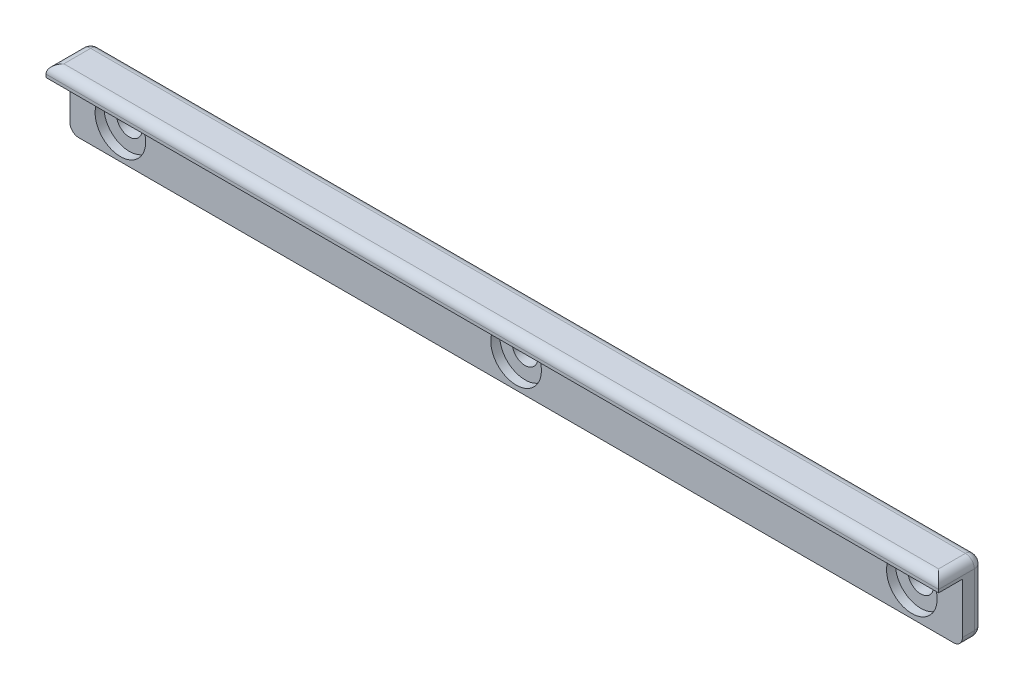
from build123d import *

# Parameters (mm, degrees)
SKETCH1_W                = 150
SKETCH1_H                = 10
SKETCH1_R                = 4.25
BOSS_EXTRUDE1_DEPTH      = 1.5
SKETCH2_W                = 150
SKETCH2_H                = 10
SKETCH2_R                = 2.15
BOSS_EXTRUDE2_DEPTH      = 2
BOSS_EXTRUDE3_DEPTH      = 4
BOSS_EXTRUDE3_DEPTH_BACK = 3.5
SKETCH3_W                = 150
SKETCH3_H                = 2
FILLET1_R                = 1.5


with BuildPart() as part:
    # Sketch1 → Boss-Extrude1 (new body)
    with BuildSketch(Plane.XY):
        with Locations((75, -5)):
            Rectangle(SKETCH1_W, SKETCH1_H)
        with Locations((75, -5)):
            Circle(SKETCH1_R, mode=Mode.SUBTRACT)
        with Locations((141.5, -5)):
            Circle(SKETCH1_R, mode=Mode.SUBTRACT)
        with Locations((8.5, -5)):
            Circle(SKETCH1_R, mode=Mode.SUBTRACT)
    extrude(amount=BOSS_EXTRUDE1_DEPTH)

    # Sketch2 → Boss-Extrude2 (add)
    with BuildSketch(Plane(origin=(0, 0, 0), x_dir=(-1, 0, 0), z_dir=(0, 0, -1))):
        with Locations((-75, -5)):
            Rectangle(SKETCH2_W, SKETCH2_H)
        with Locations((-8.5, -5)):
            Circle(SKETCH2_R, mode=Mode.SUBTRACT)
        with Locations((-75, -5)):
            Circle(SKETCH2_R, mode=Mode.SUBTRACT)
        with Locations((-141.5, -5)):
            Circle(SKETCH2_R, mode=Mode.SUBTRACT)
    extrude(amount=BOSS_EXTRUDE2_DEPTH)

    # Sketch3 → Boss-Extrude3 (add, two sides: drawn at the far end of the back side and taken through both)
    with BuildSketch(Plane.XY.offset(1.5).offset(-BOSS_EXTRUDE3_DEPTH_BACK)):
        with Locations((75, 1)):
            Rectangle(SKETCH3_W, SKETCH3_H)
    extrude(amount=BOSS_EXTRUDE3_DEPTH + BOSS_EXTRUDE3_DEPTH_BACK)

    # Fillet1
    fillet1_edges = [part.edges().sort_by_distance(p)[0] for p in [
        (150, -4, -2),
        (75, -10, -2),
        (0, -4, -2),
        (0, 2, 1.75),
        (75, 2, -2),
        (150, 2, 1.75),
        (75, 2, 5.5),
        (150, -10, -0.25),
        (0, -10, -0.25),
    ]]
    fillet(fillet1_edges, radius=FILLET1_R)


solid = part.part
